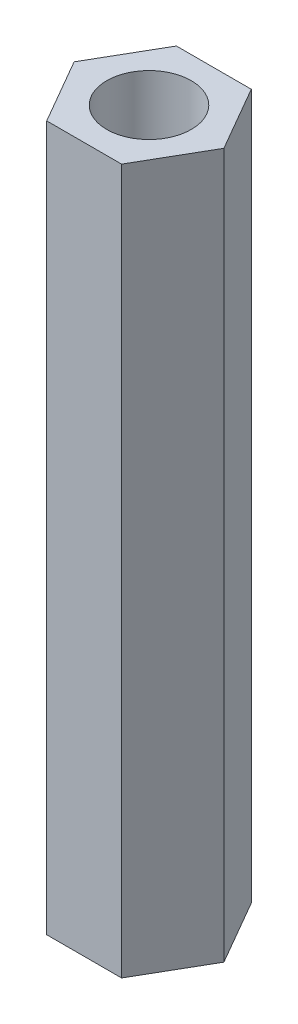
from build123d import *

# Parameters (mm, degrees)
SKETCH_1_R      = 1.5
EXTRUDE_1_DEPTH = 25


with BuildPart() as part:
    # 草图1 → 凸台-拉伸1 (new body)
    with BuildSketch(Plane(origin=(0, 0, 0), x_dir=(1, 0, 0), z_dir=(0, 1, 0))):
        Polygon((2.655811238, 0), (1.327905619, 2.3), (-1.327905619, 2.3), (-2.655811238, 0), (-1.327905619, -2.3), (1.327905619, -2.3), align=None)
        with Locations(Location((0, 0, 0), (0, 0, 270))):
            Circle(SKETCH_1_R, mode=Mode.SUBTRACT)
    extrude(amount=EXTRUDE_1_DEPTH)


solid = part.part
